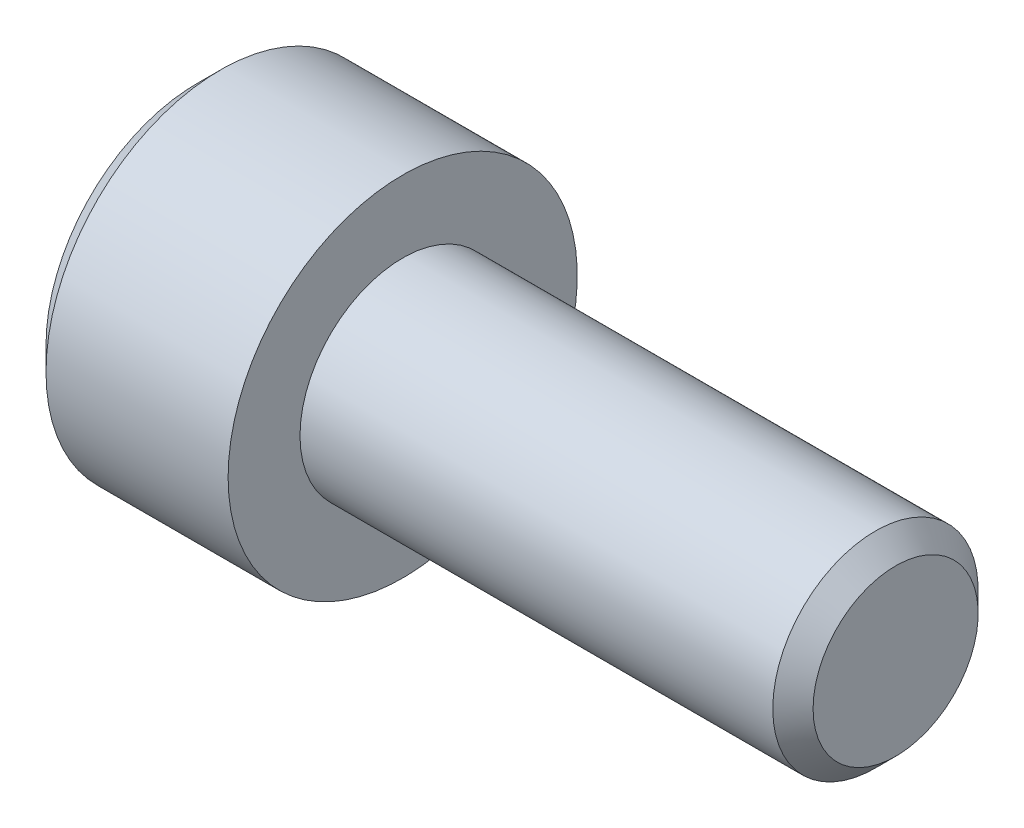
from build123d import *

# Parameters (mm, degrees)
CUT_EXTRUDE_1_DEPTH = 2.5


with BuildPart() as part:
    # 草圖1 → 旋轉1 (revolve)
    with BuildSketch(Plane.XY, mode=Mode.PRIVATE) as revolve_1_sk:
        Polygon((-5, 0), (-5, 3.683333333), (-4.433333333, 4.25), (0, 4.25), (0, 2.5), (11.5095, 2.5), (12, 2.0095), (12, 0), align=None)
    revolve(revolve_1_sk.sketch.rotate(Axis((12, 0, 0), (-1, 0, 0)), 270), axis=Axis((12, 0, 0), (-1, 0, 0)))

    # 草圖2 → 除料-旋轉1 (revolve, cut)
    with BuildSketch(Plane.XY, mode=Mode.PRIVATE) as cut_revolve_1_sk:
        Polygon((-5, 0), (-5, 2), (-2.5, 2), (-1.964101615, 0), align=None)
    revolve(cut_revolve_1_sk.sketch.rotate(Axis((-1.964101615, 0, 0), (-1, 0, 0)), 270), axis=Axis((-1.964101615, 0, 0), (-1, 0, 0)), mode=Mode.SUBTRACT)

    # 草圖3 → 除料-伸長1 (cut)
    with BuildSketch(Plane(origin=(-5, 0, 0), x_dir=(0, 0, -1), z_dir=(1, 0, 0))):
        Polygon((-2, 1.154700538), (-2, -1.154700538), (0, -2.309401077), (2, -1.154700538), (2, 1.154700538), (0, 2.309401077), align=None)
    extrude(amount=CUT_EXTRUDE_1_DEPTH, mode=Mode.SUBTRACT)


solid = part.part
